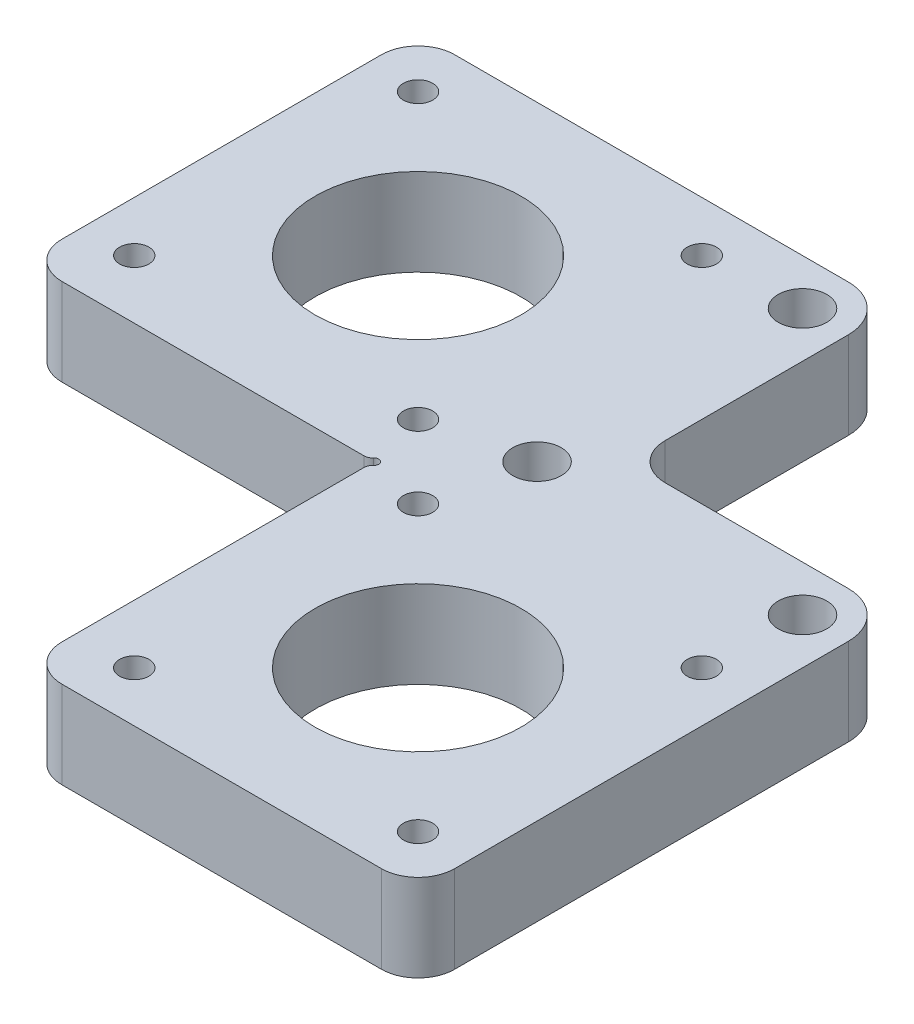
from build123d import *

# Parameters (mm, degrees)
BOSS_EXTRUDE1_DEPTH          = 9.525
F_22_5_22_5_DIAMETER_HOLE1_D = 22.5
M3_CLEARANCE_HOLE1_D         = 3.2
M5_CLEARANCE_HOLE1_D         = 5.3
BOSS_EXTRUDE2_DEPTH          = 9.525
SKETCH17_R                   = 0.5
CUT_EXTRUDE1_DEPTH           = 9.525
FILLET2_R                    = 4
FILLET3_R                    = 5
FILLET4_R                    = 1


with BuildPart() as part:
    # Sketch1 → Boss-Extrude1 (new body)
    with BuildSketch(Plane(origin=(0, 0, 0), x_dir=(1, 0, 0), z_dir=(0, 1, 0))):
        Polygon((60, -21), (60, 31), (31, 31), (31, 60), (-21, 60), (-21, 18), (18, 18), (18, -21), align=None)
    extrude(amount=BOSS_EXTRUDE1_DEPTH)

    # Ø22.5 (22.5) Diameter Hole1 (through all)
    with Locations(Plane(origin=(0, 9.525, 0), x_dir=(1, 0, 0), z_dir=(0, 1, 0))):
        with Locations((0, 39), (39, 0)):
            Hole(F_22_5_22_5_DIAMETER_HOLE1_D / 2)

    # M3 Clearance Hole1 (through all)
    with Locations(Plane(origin=(0, 0, 0), x_dir=(-1, 0, 0), z_dir=(0, -1, 0))):
        with Locations((-54.5, 15.5), (-23.5, 15.5), (-23.5, -15.5), (-54.5, -15.5), (-15.5, 54.5), (-15.5, 23.5), (15.5, 23.5), (15.5, 54.5)):
            Hole(M3_CLEARANCE_HOLE1_D / 2)

    # M5 Clearance Hole1 (through all)
    with Locations(Plane(origin=(0, 9.525, 0), x_dir=(1, 0, 0), z_dir=(0, 1, 0))):
        with Locations((26, 55), (26, 26), (55, 26)):
            Hole(M5_CLEARANCE_HOLE1_D / 2)

    # Sketch16 → Boss-Extrude2 (add)
    with BuildSketch(Plane(origin=(0, 9.525, 0), x_dir=(1, 0, 0), z_dir=(0, 1, 0))):
        Polygon((17.1, 17.1), (-21, 17.1), (-21, 18), (18, 18), (18, -21), (17.1, -21), align=None)
    extrude(amount=-BOSS_EXTRUDE2_DEPTH)

    # Sketch17 → Cut-Extrude1 (cut)
    with BuildSketch(Plane(origin=(0, 9.525, 0), x_dir=(1, 0, 0), z_dir=(0, 1, 0))):
        with Locations((17.1, 17.1)):
            Circle(SKETCH17_R)
    extrude(amount=-CUT_EXTRUDE1_DEPTH, mode=Mode.SUBTRACT)

    # Fillet2
    fillet2_edges = [part.edges().sort_by_distance(p)[0] for p in [
        (17.1, 4.7625, 21),
        (-21, 4.7625, -17.1),
        (-21, 4.7625, -60),
        (31, 4.7625, -31),
        (60, 4.7625, 21),
    ]]
    fillet(fillet2_edges, radius=FILLET2_R)

    # Fillet3
    fillet3_edges = [part.edges().sort_by_distance(p)[0] for p in [
        (31, 4.7625, -60),
        (60, 4.7625, -31),
    ]]
    fillet(fillet3_edges, radius=FILLET3_R)

    # Fillet4
    fillet4_edges = [part.edges().sort_by_distance(p)[0] for p in [
        (16.6, 4.7625, -17.1),
        (17.1, 4.7625, -16.6),
    ]]
    fillet(fillet4_edges, radius=FILLET4_R)


solid = part.part
